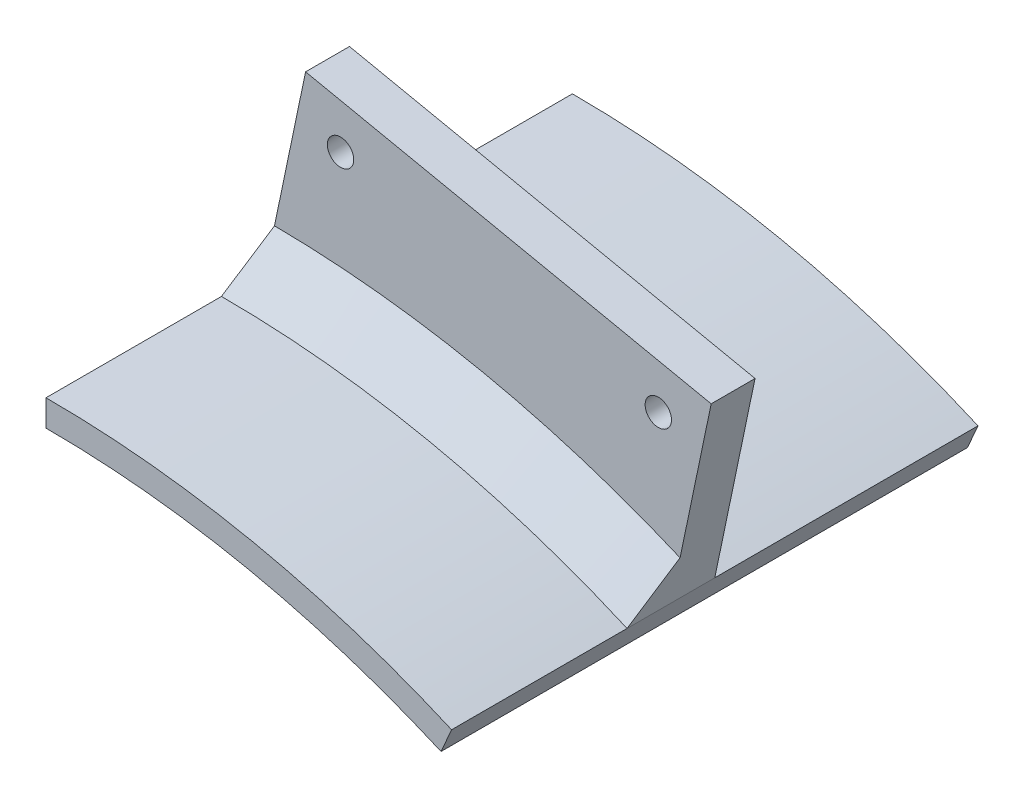
from build123d import *

# Parameters (mm, degrees)
EXTRUDE_1_DEPTH = 60
EXTRUDE_START   = 5
SKETCH_2_R      = 1.5
EXTRUDE_2_DEPTH = 5
CHAMFER_1_SIZE  = 5


with BuildPart() as part:
    # 草图1 → 凸台-拉伸1 (new body)
    with BuildSketch(Plane.XY):
        with BuildLine():
            Line((0, 112.5), (0, 115.5))
            ThreePointArc((0, 115.5), (23.613333333, 113.060428484), (46.22915298, 105.84477037))
            Line((46.22915298, 105.84477037), (45.02839576, 103.095555556))
            ThreePointArc((45.02839576, 103.095555556), (23, 110.123793978), (0, 112.5))
        make_face()
    extrude(amount=EXTRUDE_1_DEPTH)

    # 草图2 → 凸台-拉伸2 (add)
    with BuildSketch(Plane(origin=(0, 0, 35), x_dir=(-1, 0, 0), z_dir=(0, 0, -1)).offset(EXTRUDE_START)):
        with BuildLine():
            Line((-27.702222222, 132.637991857), (-4.587645732, 137.465606672))
            Line((-4.587645732, 137.465606672), (0, 115.5))
            ThreePointArc((0, 115.5), (-23.613333333, 113.060428484), (-46.22915298, 105.84477037))
            Line((-46.22915298, 105.84477037), (-50.816798712, 127.810377043))
            Line((-50.816798712, 127.810377043), (-27.702222222, 132.637991857))
        make_face()
        with Locations((-8.570753879, 131.525823236)):
            Circle(SKETCH_2_R, mode=Mode.SUBTRACT)
        with Locations(Location((-44.789246121, 123.961378792, 0), (0, 0, 180))):
            Circle(SKETCH_2_R, mode=Mode.SUBTRACT)
    extrude(amount=-EXTRUDE_2_DEPTH)

    # 倒角1
    chamfer_1_edges = [part.edges().sort_by_distance(p)[0] for p in [
        (23.613333333, 113.060428484, 35),
    ]]
    chamfer(chamfer_1_edges, length=CHAMFER_1_SIZE)


solid = part.part
